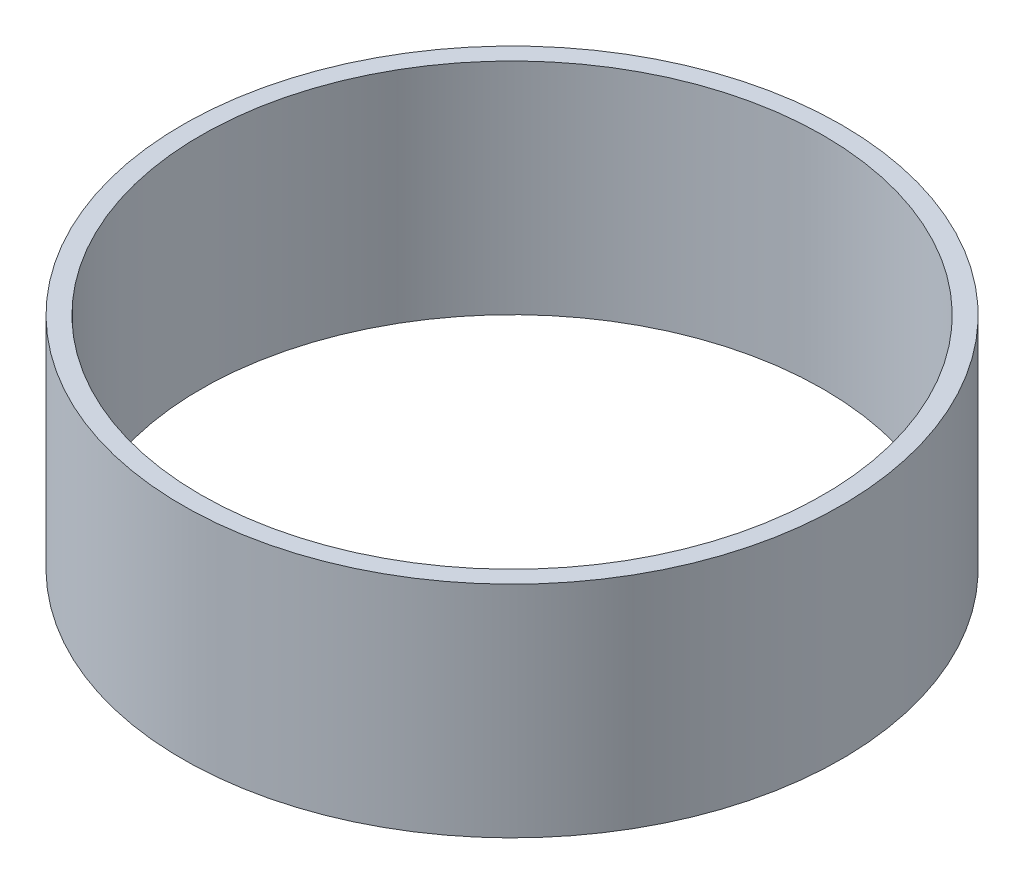
from build123d import *

# Parameters (mm, degrees)
SKETCH1_R           = 1828.8
SKETCH1_R_2         = 1727.2
BOSS_EXTRUDE1_DEPTH = 1219.2


with BuildPart() as part:
    # Sketch1 → Boss-Extrude1 (new body)
    with BuildSketch(Plane(origin=(0, 0, 0), x_dir=(1, 0, 0), z_dir=(0, 1, 0))):
        with Locations(Location((0, 0, 0), (0, 0, 90))):
            Circle(SKETCH1_R)
        with Locations(Location((0, 0, 0), (0, 0, 90))):
            Circle(SKETCH1_R_2, mode=Mode.SUBTRACT)
    extrude(amount=BOSS_EXTRUDE1_DEPTH)


solid = part.part
